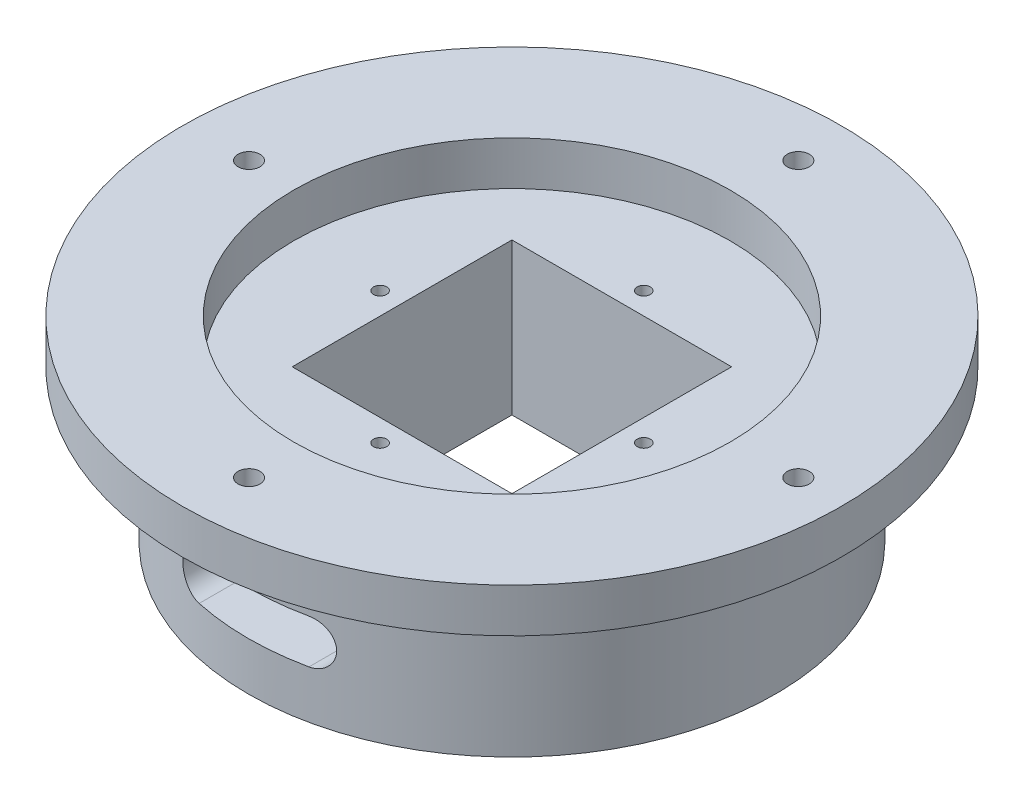
from build123d import *

# Parameters (mm, degrees)
SKETCH_1_R           = 120
SKETCH_1_R_2         = 3
SKETCH_1_W           = 100
SKETCH_1_H           = 100
EXTRUDE_3_DEPTH      = 69
SKETCH_8_R           = 150
SKETCH_8_R_2         = 99.33727818
EXTRUDE_6_DEPTH      = 20
SKETCH_9_R           = 5
CUT_EXTRUDE_11_DEPTH = 10
CUT_EXTRUDE_12_DEPTH = 76


with BuildPart() as part:
    # 草图1 → 凸台-拉伸3 (new body)
    with BuildSketch(Plane(origin=(0, 0, 0), x_dir=(1, 0, 0), z_dir=(0, 1, 0))):
        with Locations(Location((-30.656096769, -1.474017122, 0), (0, 0, 270))):
            Circle(SKETCH_1_R)
        with Locations(Location((-90.656096769, -1.474017122, 0), (0, 0, 270))):
            Circle(SKETCH_1_R_2, mode=Mode.SUBTRACT)
        with Locations(Location((29.343903231, -1.474017122, 0), (0, 0, 270))):
            Circle(SKETCH_1_R_2, mode=Mode.SUBTRACT)
        with Locations(Location((-30.656096769, -61.474017122, 0), (0, 0, 270))):
            Circle(SKETCH_1_R_2, mode=Mode.SUBTRACT)
        with Locations(Location((-30.656096769, 58.525982878, 0), (0, 0, 270))):
            Circle(SKETCH_1_R_2, mode=Mode.SUBTRACT)
        with Locations((-30.656096769, -1.474017122)):
            Rectangle(SKETCH_1_W, SKETCH_1_H, mode=Mode.SUBTRACT)
    extrude(amount=EXTRUDE_3_DEPTH)

    # 草图8 → 凸台-拉伸6 (add)
    with BuildSketch(Plane(origin=(0, 69, 0), x_dir=(1, 0, 0), z_dir=(0, 1, 0))):
        with Locations(Location((-30.656096769, -1.474017122, 0), (0, 0, 270))):
            Circle(SKETCH_8_R)
        with Locations(Location((-30.656096769, -1.474017122, 0), (0, 0, 270))):
            Circle(SKETCH_8_R_2, mode=Mode.SUBTRACT)
    extrude(amount=EXTRUDE_6_DEPTH)

    # 草图9 → 切除-拉伸11 (cut)
    with BuildSketch(Plane(origin=(0, 89, 0), x_dir=(1, 0, 0), z_dir=(0, 1, 0))):
        with Locations(Location((-26.787702046, 125, 0), (0, 0, 270))):
            Circle(SKETCH_9_R)
        with Locations(Location((98.212297954, 0, 0), (0, 0, 270))):
            Circle(SKETCH_9_R)
        with Locations(Location((-26.787702046, -125, 0), (0, 0, 270))):
            Circle(SKETCH_9_R)
        with Locations(Location((-151.787702046, 0, 0), (0, 0, 270))):
            Circle(SKETCH_9_R)
    extrude(amount=-CUT_EXTRUDE_11_DEPTH, mode=Mode.SUBTRACT)

    # 草图10 → 切除-拉伸12 (cut)
    with BuildSketch(Plane(origin=(0, 0, 51.474017122), x_dir=(-1, 0, 0), z_dir=(0, 0, -1))):
        with BuildLine():
            Line((55.656096769, 21.899366297), (5.656196663, 21.899366297))
            ThreePointArc((5.656196663, 21.899366297), (-4.343803337, 31.899366297), (5.656196663, 41.899366297))
            Line((5.656196663, 41.899366297), (55.656096769, 41.899366297))
            ThreePointArc((55.656096769, 41.899366297), (65.656096769, 31.899366297), (55.656096769, 21.899366297))
        make_face()
    extrude(amount=-CUT_EXTRUDE_12_DEPTH, mode=Mode.SUBTRACT)


solid = part.part
